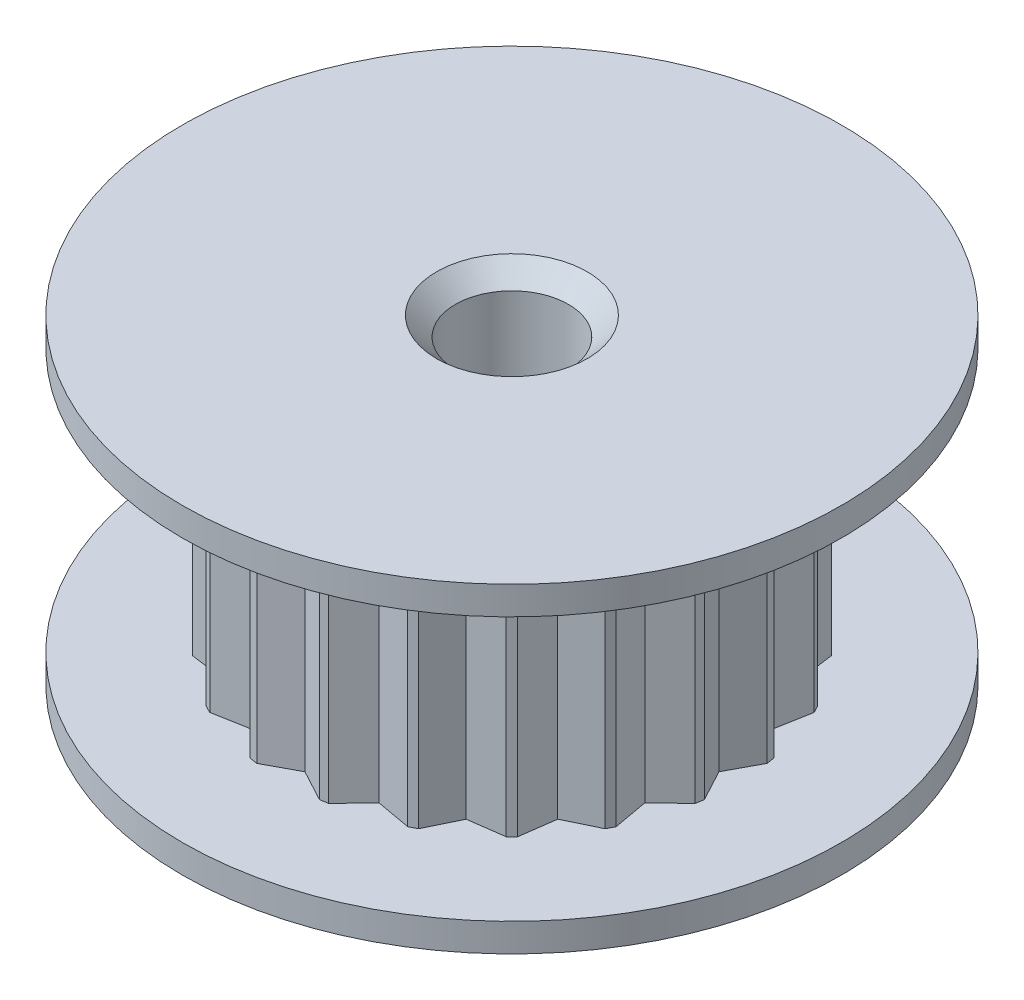
from build123d import *

# Parameters (mm, degrees)
SKETCH1_R               = 8.75
SKETCH1_R_2             = 1.5
BOSS_EXTRUDE1_DEPTH     = 8.5
CUT_EXTRUDE2_DEPTH      = 3.5
CUT_EXTRUDE2_DEPTH_BACK = 3.5
CUT_EXTRUDE2_START      = -4.25
SKETCH2_R               = 9
SKETCH2_R_2             = 6
CUT_EXTRUDE5_START      = -0.75
CUT_EXTRUDE5_DEPTH      = 7
CHAMFER1_SIZE           = 0.5


with BuildPart() as part:
    # Sketch1 → Boss-Extrude1 (new body)
    with BuildSketch(Plane(origin=(0, 0, 0), x_dir=(1, 0, 0), z_dir=(0, 1, 0))):
        with Locations(Location((0, 0, 0), (0, 0, 270))):
            Circle(SKETCH1_R)
        with Locations(Location((0, 0, 0), (0, 0, 270))):
            Circle(SKETCH1_R_2, mode=Mode.SUBTRACT)
    extrude(amount=BOSS_EXTRUDE1_DEPTH)

    # Sketch2 → Cut-Extrude2 (cut, two sides: drawn at the far end of the back side and taken through both)
    with BuildSketch(Plane(origin=(0, 8.5, 0), x_dir=(1, 0, 0), z_dir=(0, 1, 0)).offset(CUT_EXTRUDE2_START - CUT_EXTRUDE2_DEPTH_BACK)):
        Circle(SKETCH2_R)
        with Locations(Location((0, 0, 0), (0, 0, 270))):
            Circle(SKETCH2_R_2, mode=Mode.SUBTRACT)
    extrude(amount=CUT_EXTRUDE2_DEPTH + CUT_EXTRUDE2_DEPTH_BACK, mode=Mode.SUBTRACT)

    # Sketch4 → Cut-Extrude5 (cut)
    with BuildSketch(Plane(origin=(0, 8.5, 0), x_dir=(1, 0, 0), z_dir=(0, 1, 0)).offset(CUT_EXTRUDE5_START)):
        with BuildLine():
            ThreePointArc((3.526710889, 4.85410242), (3.180827716, 5.087468432), (2.81956216, 5.296231606))
            Line((2.81956216, 5.296231606), (3.230259184, 4.44607034))
            Line((3.230259184, 4.44607034), (4.165722957, 4.318188538))
            ThreePointArc((4.165722957, 4.318188538), (3.855539591, 4.597261626), (3.526710889, 4.85410242))
        make_face()
        with BuildLine():
            ThreePointArc((4.854101297, 3.526712434), (4.597261012, 3.855540323), (4.318188538, 4.165722957))
            Line((4.318188538, 4.165722957), (4.44607034, 3.230259184))
            Line((4.44607034, 3.230259184), (5.296231606, 2.81956216))
            ThreePointArc((5.296231606, 2.81956216), (5.087467925, 3.180828525), (4.854101297, 3.526712434))
        make_face()
        with BuildLine():
            ThreePointArc((1.85410212, 5.706339048), (1.453033176, 5.821399711), (1.044937393, 5.908308205))
            Line((1.044937393, 5.908308205), (1.698247753, 5.226669153))
            Line((1.698247753, 5.226669153), (2.62744432, 5.394120535))
            ThreePointArc((2.62744432, 5.394120535), (2.246204515, 5.563682708), (1.85410212, 5.706339048))
        make_face()
        with BuildLine():
            ThreePointArc((0.831973127, 5.942038431), (0.416994825, 5.98549207), (-5.4e-08, 6))
            ThreePointArc((-5.4e-08, 6), (-0.416994879, 5.985492066), (-0.831973127, 5.942038431))
            Line((-0.831973127, 5.942038431), (0, 5.495645173))
            Line((0, 5.495645173), (0.831973127, 5.942038431))
        make_face()
        with BuildLine():
            Line((-1.698247753, 5.226669153), (-1.044937393, 5.908308205))
            ThreePointArc((-1.044937393, 5.908308205), (-1.453033133, 5.821399721), (-1.854102038, 5.706339075))
            ThreePointArc((-1.854102038, 5.706339075), (-2.246204475, 5.563682724), (-2.62744432, 5.394120535))
            Line((-2.62744432, 5.394120535), (-1.698247753, 5.226669153))
        make_face()
        with BuildLine():
            Line((-3.230259184, 4.44607034), (-2.81956216, 5.296231606))
            ThreePointArc((-2.81956216, 5.296231606), (-3.180828024, 5.087468239), (-3.526711477, 4.854101993))
            ThreePointArc((-3.526711477, 4.854101993), (-3.85553987, 4.597261392), (-4.165722957, 4.318188538))
            Line((-4.165722957, 4.318188538), (-3.230259184, 4.44607034))
        make_face()
        with BuildLine():
            Line((-4.44607034, 3.230259184), (-4.318188538, 4.165722957))
            ThreePointArc((-4.318188538, 4.165722957), (-4.597261623, 3.855539595), (-4.854102415, 3.526710897))
            ThreePointArc((-4.854102415, 3.526710897), (-5.087468429, 3.18082772), (-5.296231606, 2.81956216))
            Line((-5.296231606, 2.81956216), (-4.44607034, 3.230259184))
        make_face()
        with BuildLine():
            Line((-5.226669153, 1.698247753), (-5.394120535, 2.62744432))
            ThreePointArc((-5.394120535, 2.62744432), (-5.563682526, 2.246204966), (-5.706338747, 1.854103044))
            ThreePointArc((-5.706338747, 1.854103044), (-5.821399593, 1.453033647), (-5.908308205, 1.044937393))
            Line((-5.908308205, 1.044937393), (-5.226669153, 1.698247753))
        make_face()
        with BuildLine():
            ThreePointArc((5.70633865, 1.854103345), (5.563682467, 2.246205112), (5.394120535, 2.62744432))
            Line((5.394120535, 2.62744432), (5.226669153, 1.698247753))
            Line((5.226669153, 1.698247753), (5.908308205, 1.044937393))
            ThreePointArc((5.908308205, 1.044937393), (5.821399555, 1.4530338), (5.70633865, 1.854103345))
        make_face()
        with BuildLine():
            ThreePointArc((6, 0), (5.985492068, 0.416994852), (5.942038431, 0.831973127))
            Line((5.942038431, 0.831973127), (5.495645173, 0))
            Line((5.495645173, 0), (5.942038431, -0.831973127))
            ThreePointArc((5.942038431, -0.831973127), (5.985492068, -0.416994852), (6, 0))
        make_face()
        with BuildLine():
            ThreePointArc((5.706339698, -1.854100118), (5.821399966, -1.453032154), (5.908308205, -1.044937393))
            Line((5.908308205, -1.044937393), (5.226669153, -1.698247753))
            Line((5.226669153, -1.698247753), (5.394120535, -2.62744432))
            ThreePointArc((5.394120535, -2.62744432), (5.563683102, -2.246203539), (5.706339698, -1.854100118))
        make_face()
        with BuildLine():
            Line((-5.495645173, 0), (-5.942038431, 0.831973127))
            ThreePointArc((-5.942038431, 0.831973127), (-5.985492068, 0.416994852), (-6, 0))
            ThreePointArc((-6, 0), (-5.985492068, -0.416994852), (-5.942038431, -0.831973127))
            Line((-5.942038431, -0.831973127), (-5.495645173, 0))
        make_face()
        with BuildLine():
            Line((-4.44607034, -3.230259184), (-5.296231606, -2.81956216))
            ThreePointArc((-5.296231606, -2.81956216), (-5.087467714, -3.180828864), (-4.854100828, -3.526713081))
            ThreePointArc((-4.854100828, -3.526713081), (-4.597260756, -3.855540629), (-4.318188538, -4.165722957))
            Line((-4.318188538, -4.165722957), (-4.44607034, -3.230259184))
        make_face()
        with BuildLine():
            Line((-3.230259184, -4.44607034), (-4.165722957, -4.318188538))
            ThreePointArc((-4.165722957, -4.318188538), (-3.855540695, -4.5972607), (-3.52671322, -4.854100727))
            ThreePointArc((-3.52671322, -4.854100727), (-3.180828937, -5.087467668), (-2.81956216, -5.296231606))
            Line((-2.81956216, -5.296231606), (-3.230259184, -4.44607034))
        make_face()
        with BuildLine():
            Line((-1.698247753, -5.226669153), (-2.62744432, -5.394120535))
            ThreePointArc((-2.62744432, -5.394120535), (-2.246203408, -5.563683155), (-1.854099848, -5.706339786))
            ThreePointArc((-1.854099848, -5.706339786), (-1.453032017, -5.8214), (-1.044937393, -5.908308205))
            Line((-1.044937393, -5.908308205), (-1.698247753, -5.226669153))
        make_face()
        with BuildLine():
            Line((0, -5.495645173), (-0.831973127, -5.942038431))
            ThreePointArc((-0.831973127, -5.942038431), (-0.416994852, -5.985492068), (1e-09, -6))
            ThreePointArc((1e-09, -6), (0.416994853, -5.985492068), (0.831973127, -5.942038431))
            Line((0.831973127, -5.942038431), (0, -5.495645173))
        make_face()
        with BuildLine():
            ThreePointArc((1.854099793, -5.706339804), (2.246203381, -5.563683166), (2.62744432, -5.394120535))
            Line((2.62744432, -5.394120535), (1.698247753, -5.226669153))
            Line((1.698247753, -5.226669153), (1.044937393, -5.908308205))
            ThreePointArc((1.044937393, -5.908308205), (1.453031988, -5.821400007), (1.854099793, -5.706339804))
        make_face()
        with BuildLine():
            ThreePointArc((3.526713316, -4.854100657), (3.855540741, -4.597260662), (4.165722957, -4.318188538))
            Line((4.165722957, -4.318188538), (3.230259184, -4.44607034))
            Line((3.230259184, -4.44607034), (2.81956216, -5.296231606))
            ThreePointArc((2.81956216, -5.296231606), (3.180828987, -5.087467637), (3.526713316, -4.854100657))
        make_face()
        with BuildLine():
            ThreePointArc((4.854100726, -3.52671322), (5.087467668, -3.180828937), (5.296231606, -2.81956216))
            Line((5.296231606, -2.81956216), (4.44607034, -3.230259184))
            Line((4.44607034, -3.230259184), (4.318188538, -4.165722957))
            ThreePointArc((4.318188538, -4.165722957), (4.5972607, -3.855540695), (4.854100726, -3.52671322))
        make_face()
        Polygon((-5.226669153, -1.698247753), (-5.415863123, -2.748095092), (-5.996815072, -0.960108841), align=None)
    extrude(amount=-CUT_EXTRUDE5_DEPTH, mode=Mode.SUBTRACT)

    # Chamfer1
    chamfer1_edges = [part.edges().sort_by_distance(p)[0] for p in [
        (0, 0, -1.5),
        (0, 8.5, -1.5),
    ]]
    chamfer(chamfer1_edges, length=CHAMFER1_SIZE)


solid = part.part
